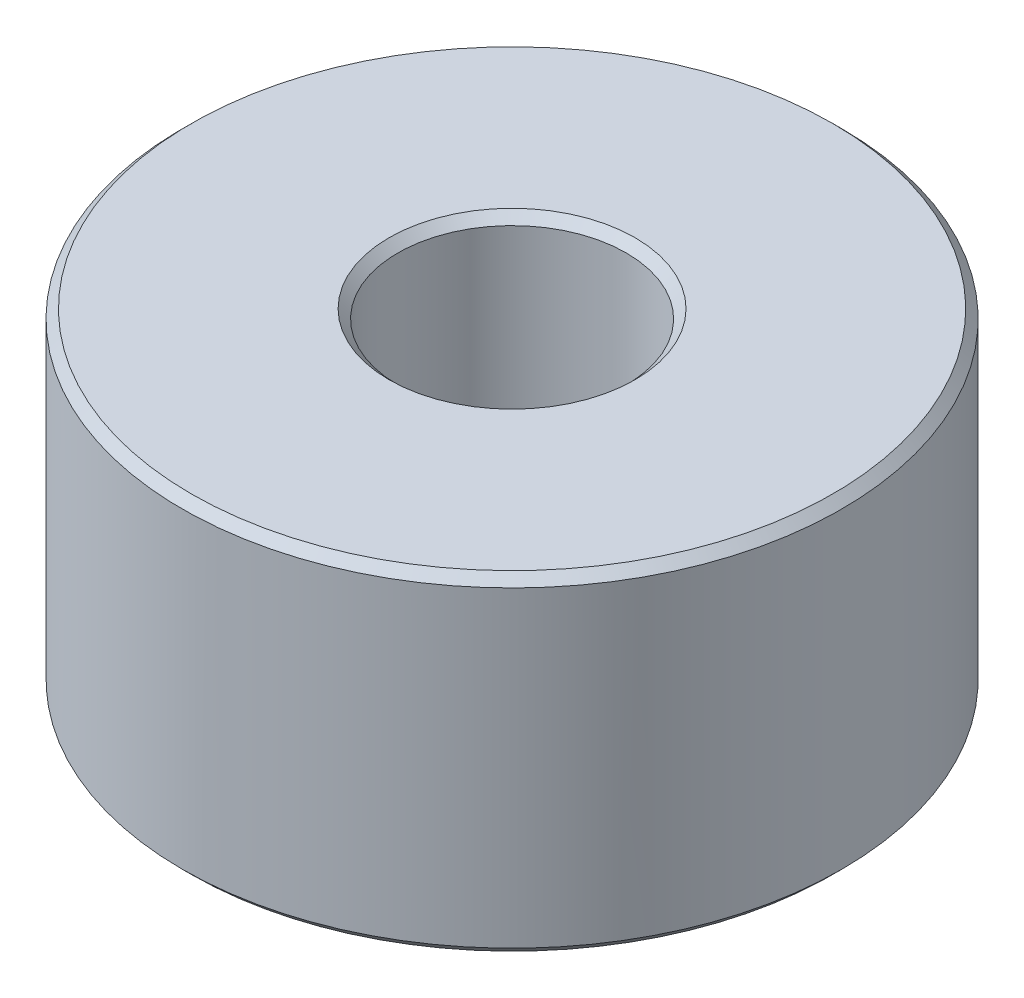
from build123d import *

# Parameters (mm, degrees)
SKETCH1_R           = 7.5
SKETCH1_R_2         = 2.6
BOSS_EXTRUDE1_DEPTH = 7.5
CHAMFER1_SIZE       = 0.2


with BuildPart() as part:
    # Sketch1 → Boss-Extrude1 (new body)
    with BuildSketch(Plane(origin=(0, 0, 0), x_dir=(1, 0, 0), z_dir=(0, 1, 0))):
        with Locations(Location((0, 0, 0), (0, 0, 270))):
            Circle(SKETCH1_R)
        with Locations(Location((0, 0, 0), (0, 0, 270))):
            Circle(SKETCH1_R_2, mode=Mode.SUBTRACT)
    extrude(amount=BOSS_EXTRUDE1_DEPTH)

    # Chamfer1
    chamfer1_edges = [part.edges().sort_by_distance(p)[0] for p in [
        (0, 0, -7.5),
        (0, 7.5, -7.5),
        (0, 0, -2.6),
        (0, 7.5, -2.6),
    ]]
    chamfer(chamfer1_edges, length=CHAMFER1_SIZE)


solid = part.part
